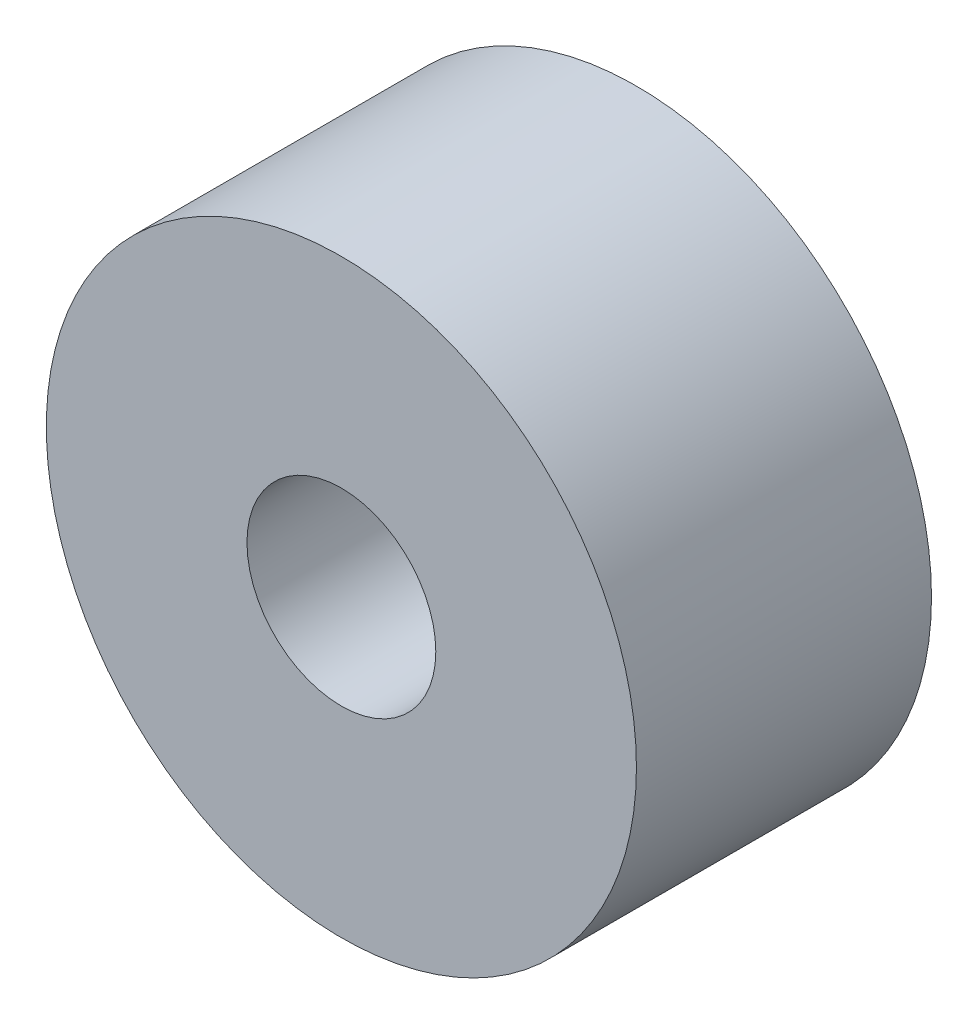
from build123d import *

# Parameters (mm, degrees)
SKETCH2_R           = 5
SKETCH2_R_2         = 1.6
BOSS_EXTRUDE1_DEPTH = 5


with BuildPart() as part:
    # Sketch2 → Boss-Extrude1 (new body)
    with BuildSketch(Plane.XY):
        Circle(SKETCH2_R)
        Circle(SKETCH2_R_2, mode=Mode.SUBTRACT)
    extrude(amount=BOSS_EXTRUDE1_DEPTH)


solid = part.part
